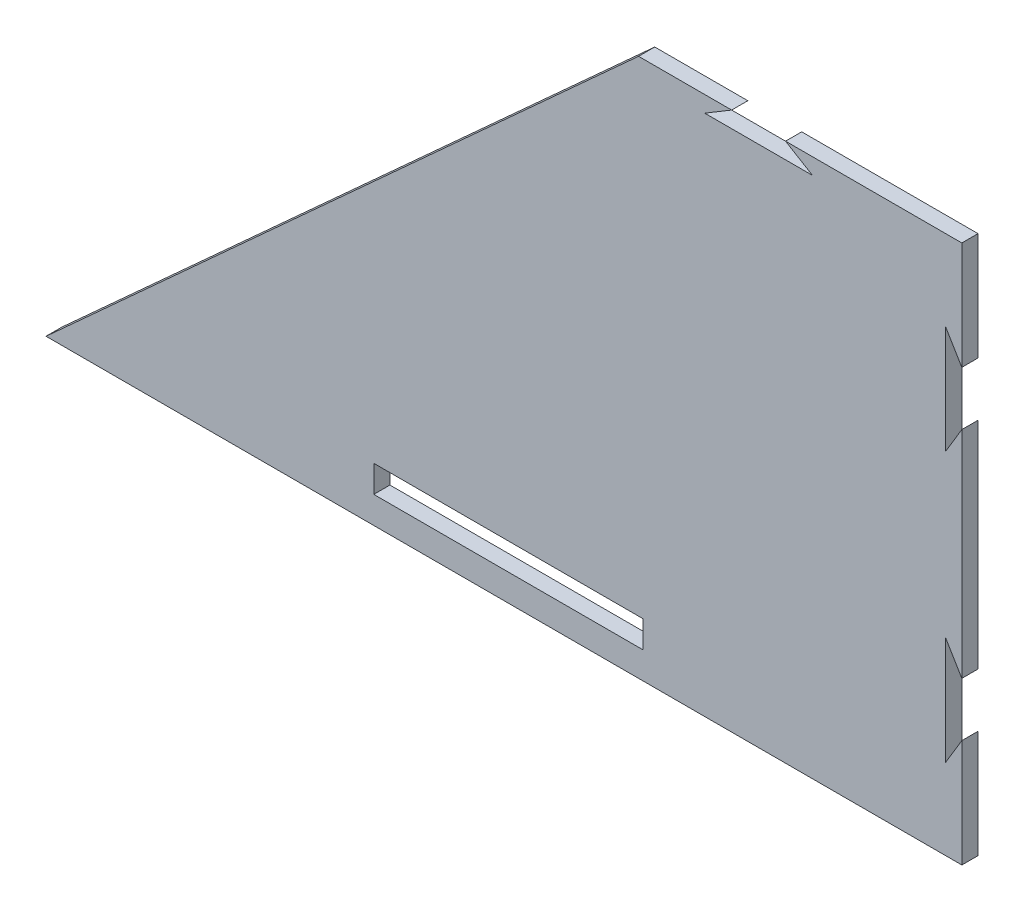
from build123d import *

# Parameters (mm, degrees)
BOSS_EXTRU_1_DEPTH           = 3
ENL_V_MAT_EXTRU_1_DEPTH      = 117.633838487
ENL_V_MAT_EXTRU_1_DEPTH_BACK = 3
ENL_V_MAT_EXTRU_2_DEPTH      = 3
ESQUISSE4_W                  = 50
ESQUISSE4_H                  = 5
ENL_V_MAT_EXTRU_3_DEPTH      = 3


with BuildPart() as part:
    # Esquisse1 → Boss.-Extru.1 (new body)
    with BuildSketch(Plane.XY):
        Polygon((-78.272102247, -71.975308642), (31.727897753, 28.024691358), (91.727897753, 28.024691358), (91.727897753, -71.975308642), align=None)
    extrude(amount=BOSS_EXTRU_1_DEPTH)

    # Esquisse2 → Enlèv. mat.-Extru.1 (cut, two sides: drawn at the far end of the back side and taken through both)
    with BuildSketch(Plane.XY.offset(3).offset(-ENL_V_MAT_EXTRU_1_DEPTH_BACK)):
        Polygon((348.843028944, 207.929257012), (49.002086188, 28.024691358), (44.002086188, 25.024691358), (64.002086188, 25.024691358), (59.002086188, 28.024691358), (-240.838856568, 207.929257012), (-240.838856568, -491.413988315), (348.843028944, -491.413988315), align=None)
    extrude(amount=ENL_V_MAT_EXTRU_1_DEPTH + ENL_V_MAT_EXTRU_1_DEPTH_BACK, mode=Mode.SUBTRACT)

    # Esquisse3 → Enlèv. mat.-Extru.2 (cut)
    with BuildSketch(Plane.XY.offset(3)):
        Polygon((91.727897753, 8.024691358), (88.727897753, 13.024691358), (88.727897753, -6.975308642), (91.727897753, -1.975308642), align=None)
        Polygon((91.727897753, -41.975308642), (88.727897753, -36.975308642), (88.727897753, -56.975308642), (91.727897753, -51.975308642), align=None)
    extrude(amount=-ENL_V_MAT_EXTRU_2_DEPTH, mode=Mode.SUBTRACT)

    # Esquisse4 → Enlèv. mat.-Extru.3 (cut)
    with BuildSketch(Plane.XY.offset(3)):
        with Locations((7.568828052, -64.475308642)):
            Rectangle(ESQUISSE4_W, ESQUISSE4_H)
    extrude(amount=-ENL_V_MAT_EXTRU_3_DEPTH, mode=Mode.SUBTRACT)


solid = part.part
